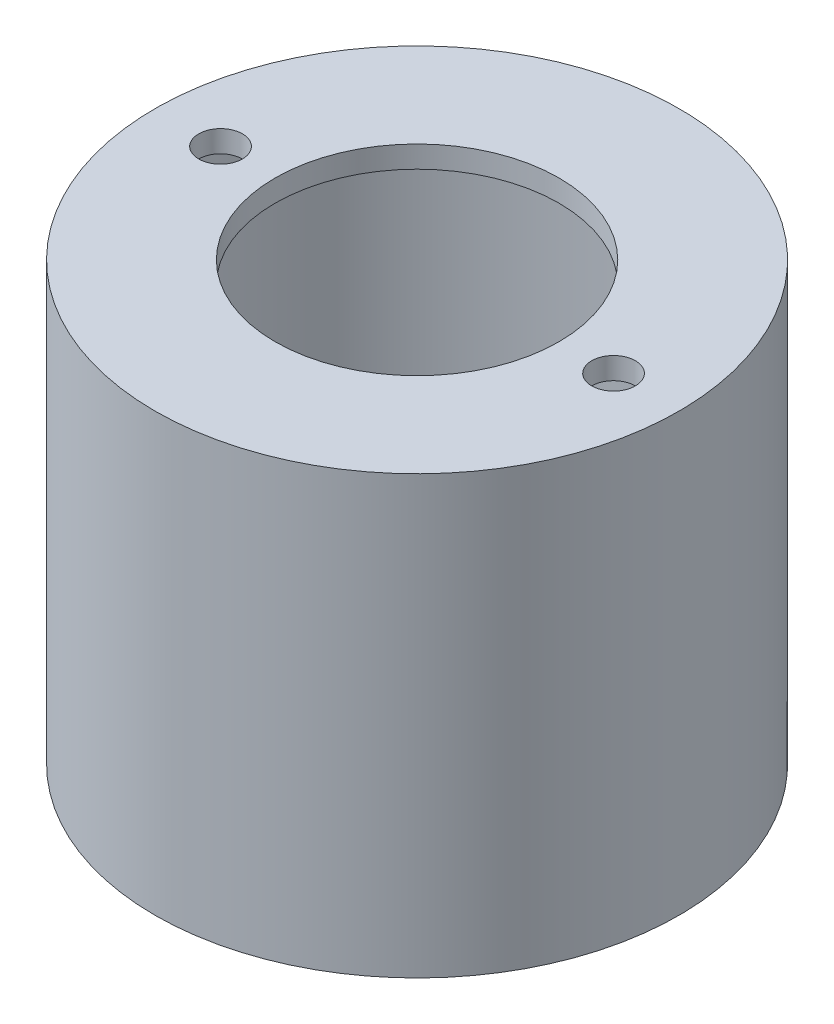
from build123d import *

# Parameters (mm, degrees)
SKETCH1_R           = 60
BOSS_EXTRUDE1_DEPTH = 100
SHELL1_T            = -5
SKETCH3_R           = 32.5
CUT_EXTRUDE1_DEPTH  = 132.148770486
SKETCH4_R           = 5
CUT_EXTRUDE2_DEPTH  = 132.148770486


with BuildPart() as part:
    # Sketch1 → Boss-Extrude1 (new body)
    with BuildSketch(Plane(origin=(0, 0, 0), x_dir=(1, 0, 0), z_dir=(0, 1, 0))):
        with Locations(Location((0, 0, 0), (0, 0, 270))):
            Circle(SKETCH1_R)
    extrude(amount=BOSS_EXTRUDE1_DEPTH)

    # Shell1
    shell1_openings = [part.faces().sort_by_distance(p)[0] for p in [
        (0, 0, 0),
    ]]
    offset(amount=SHELL1_T, openings=shell1_openings, kind=Kind.INTERSECTION)

    # Sketch3 → Cut-Extrude1 (cut, through all)
    with BuildSketch(Plane(origin=(0, 100, 0), x_dir=(1, 0, 0), z_dir=(0, 1, 0))):
        with Locations(Location((0, 0, 0), (0, 0, 270))):
            Circle(SKETCH3_R)
    extrude(amount=-CUT_EXTRUDE1_DEPTH, mode=Mode.SUBTRACT)

    # Sketch4 → Cut-Extrude2 (cut, through all)
    with BuildSketch(Plane(origin=(0, 100, 0), x_dir=(1, 0, 0), z_dir=(0, 1, 0))):
        with Locations(Location((45, 0, 0), (0, 0, 270))):
            Circle(SKETCH4_R)
        with Locations(Location((-45, 0, 0), (0, 0, 270))):
            Circle(SKETCH4_R)
    extrude(amount=-CUT_EXTRUDE2_DEPTH, mode=Mode.SUBTRACT)


solid = part.part
